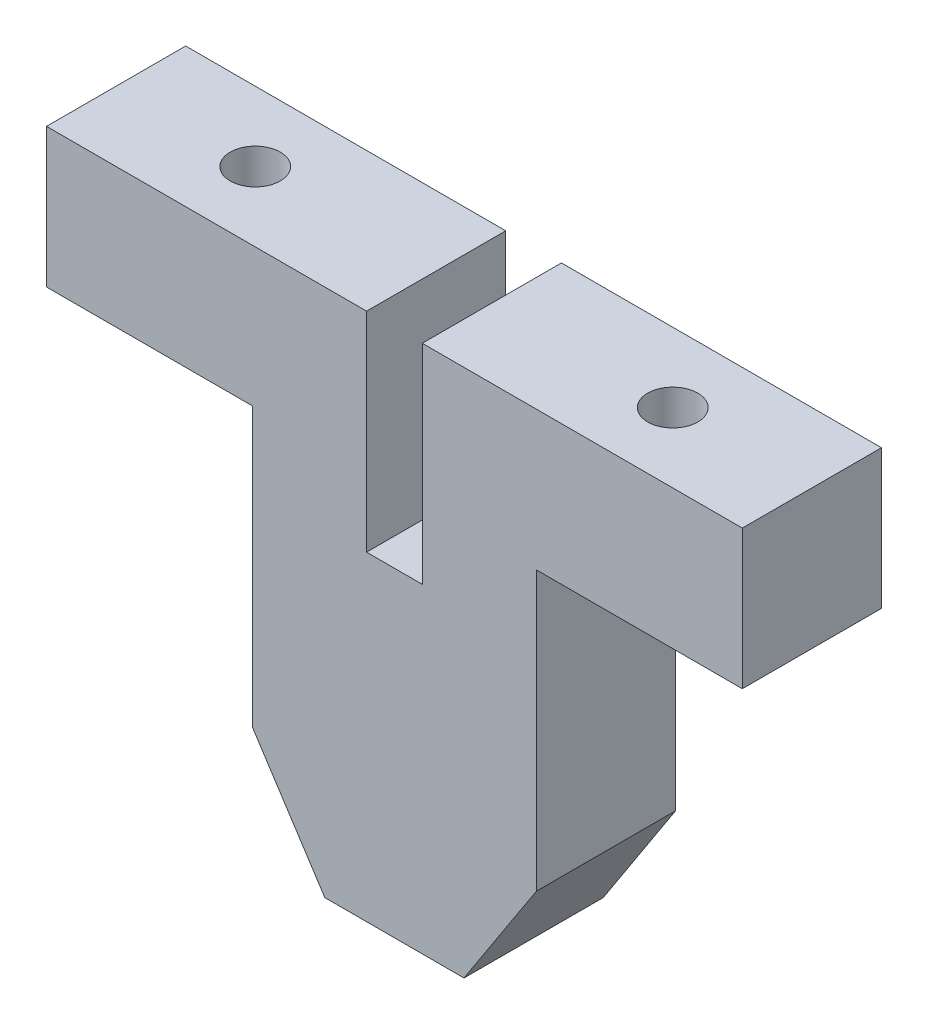
from build123d import *

# Parameters (mm, degrees)
SKETCH1_W           = 50
SKETCH1_H           = 38
BOSS_EXTRUDE1_DEPTH = 10
SKETCH2_R           = 1.8
CUT_EXTRUDE1_DEPTH  = 64.592452382
SKETCH3_W           = 4
SKETCH3_H           = 15
CUT_EXTRUDE2_DEPTH  = 10
CUT_EXTRUDE3_DEPTH  = 64.592452382


with BuildPart() as part:
    # Sketch1 → Boss-Extrude1 (new body)
    with BuildSketch(Plane.XY):
        with Locations((25, 19)):
            Rectangle(SKETCH1_W, SKETCH1_H)
    extrude(amount=BOSS_EXTRUDE1_DEPTH)

    # Sketch2 → Cut-Extrude1 (cut, through all)
    with BuildSketch(Plane(origin=(0, 38, 0), x_dir=(1, 0, 0), z_dir=(0, 1, 0))):
        with Locations(Location((10, -5, 0), (0, 0, 180))):
            Circle(SKETCH2_R)
        with Locations(Location((40, -5, 0), (0, 0, 180))):
            Circle(SKETCH2_R)
    extrude(amount=-CUT_EXTRUDE1_DEPTH, mode=Mode.SUBTRACT)

    # Sketch3 → Cut-Extrude2 (cut)
    with BuildSketch(Plane.XY.offset(10)):
        with Locations((25, 30.5)):
            Rectangle(SKETCH3_W, SKETCH3_H)
    extrude(amount=-CUT_EXTRUDE2_DEPTH, mode=Mode.SUBTRACT)

    # Sketch4 → Cut-Extrude3 (cut, through all)
    with BuildSketch(Plane.XY.offset(10)):
        Polygon((0, 28), (14.8, 28), (14.8, 8), (20, 0), (30, 0), (35.2, 8), (35.2, 28), (50, 28), (50, -1), (0, -1), align=None)
    extrude(amount=-CUT_EXTRUDE3_DEPTH, mode=Mode.SUBTRACT)


solid = part.part
